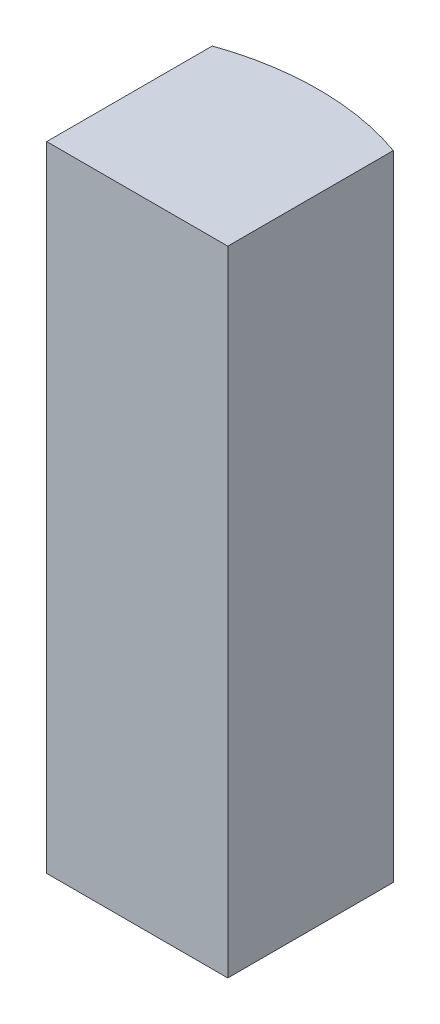
from build123d import *

# Parameters (mm, degrees)
EXTRUDE_1_DEPTH = 140


with BuildPart() as part:
    # 草图1 → 凸台-拉伸1 (new body)
    with BuildSketch(Plane(origin=(0, 0, 0), x_dir=(1, 0, 0), z_dir=(0, 1, 0))):
        with BuildLine():
            Line((-20, 56.568542495), (-20, 20))
            Line((-20, 20), (20, 20))
            Line((20, 20), (20, 56.568542495))
            ThreePointArc((20, 56.568542495), (0, 60), (-20, 56.568542495))
        make_face()
    extrude(amount=EXTRUDE_1_DEPTH)


solid = part.part
